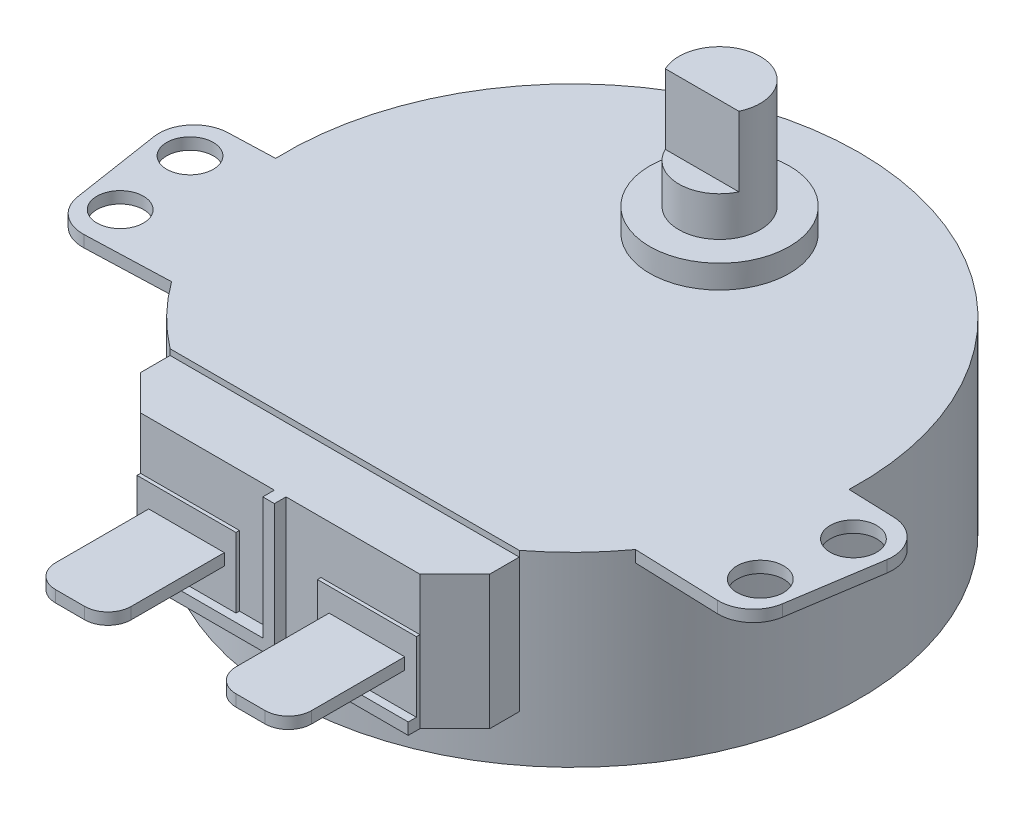
from build123d import *

# Parameters (mm, degrees)
ESBO_O1_W       = 24.65
ESBO_O1_H       = 16
ESBO_O2_W       = 30
ESBO_O2_H       = 12
EXTRUS_O1_DEPTH = 25.1
CHANFRO1_SIZE   = 3
EXTRUS_O2_DEPTH = 1
ESBO_O5_W       = 8.5
ESBO_O5_H       = 6
EXTRUS_O3_DEPTH = 0.3
ESBO_O6_W       = 6.5
ESBO_O6_H       = 1
EXTRUS_O4_DEPTH = 10
ESBO_O7_R       = 2
EXTRUS_O5_DEPTH = 1
FILETE1_R       = 3
ESBO_O8_R       = 6
EXTRUS_O6_DEPTH = 2
ESBO_O9_R       = 3.5
EXTRUS_O7_DEPTH = 9.4
ESBO_O10_W      = 6.32455532
ESBO_O10_H      = 3.599019514
EXTRUS_O8_DEPTH = 6
ESBO_O11_W      = 30
ESBO_O11_H      = 9.10840564
EXTRUS_O9_DEPTH = 0.5
FILETE2_R       = 2


with BuildPart() as part:
    # Esboço1 → Revolução1 (revolve)
    with BuildSketch(Plane.XY, mode=Mode.PRIVATE) as revolu_o1_sk:
        with Locations((-12.325, 8)):
            Rectangle(ESBO_O1_W, ESBO_O1_H)
    revolve(revolu_o1_sk.sketch.rotate(Axis((0, 0, 0), (0, 1, 0)), 270), axis=Axis((0, 0, 0), (0, 1, 0)))

    # Esboço2 → Extrusão1 (add)
    with BuildSketch(Plane.XY):
        with Locations((0, 10)):
            Rectangle(ESBO_O2_W, ESBO_O2_H)
    extrude(amount=EXTRUS_O1_DEPTH)

    # Chanfro1
    chanfro1_edges = [part.edges().sort_by_distance(p)[0] for p in [
        (-15, 10, 25.1),
        (15, 10, 25.1),
    ]]
    chamfer(chanfro1_edges, length=CHANFRO1_SIZE)

    # Esboço4 → Extrusão2 (add)
    with BuildSketch(Plane.XY.offset(25.1)):
        Polygon((-12, 5), (-0.5, 5), (-0.5, 16), (0.5, 16), (0.5, 5), (12, 5), (12, 4), (-12, 4), align=None)
    extrude(amount=EXTRUS_O2_DEPTH)

    # Esboço5 → Extrusão3 (add)
    with BuildSketch(Plane.XY.offset(25.1)):
        with Locations((-7.75, 8)):
            Rectangle(ESBO_O5_W, ESBO_O5_H)
        with Locations((7.75, 8)):
            Rectangle(ESBO_O5_W, ESBO_O5_H)
    extrude(amount=EXTRUS_O3_DEPTH)

    # Esboço6 → Extrusão4 (add)
    with BuildSketch(Plane.XY.offset(25.4)):
        with Locations((-7.75, 8.5)):
            Rectangle(ESBO_O6_W, ESBO_O6_H)
        with Locations((7.75, 8.5)):
            Rectangle(ESBO_O6_W, ESBO_O6_H)
    extrude(amount=EXTRUS_O4_DEPTH)

    # Esboço7 → Extrusão5 (add)
    # profile 1 of 2: a face of its own
    with BuildSketch(Plane(origin=(0, 16, 0), x_dir=(1, 0, 0), z_dir=(0, 1, 0))):
        with BuildLine():
            ThreePointArc((-19.930990459, -14.504417235), (-23.303909287, -8.034320875), (-24.634983886, -0.860272594))
            Line((-24.634983886, -0.860272594), (-32, -1.117464624))
            Line((-32, -1.117464624), (-29.875626197, -14.851691567))
            Line((-29.875626197, -14.851691567), (-19.930990459, -14.504417235))
        make_face()
        with Locations(Location((-27.5, -11.35, 0), (0, 0, 270))):
            Circle(ESBO_O7_R, mode=Mode.SUBTRACT)
        with Locations(Location((-28.5, -4.35, 0), (0, 0, 270))):
            Circle(ESBO_O7_R, mode=Mode.SUBTRACT)
    # profile 2 of 2: a face of its own
    with BuildSketch(Plane(origin=(0, 16, 0), x_dir=(1, 0, 0), z_dir=(0, 1, 0))):
        with BuildLine():
            Line((32, -1.117464624), (24.634983886, -0.860272594))
            ThreePointArc((24.634983886, -0.860272594), (23.303909287, -8.034320875), (19.930990459, -14.504417235))
            Line((19.930990459, -14.504417235), (29.875626197, -14.851691567))
            Line((29.875626197, -14.851691567), (32, -1.117464624))
        make_face()
        with Locations(Location((27.5, -11.35, 0), (0, 0, 270))):
            Circle(ESBO_O7_R, mode=Mode.SUBTRACT)
        with Locations(Location((28.5, -4.35, 0), (0, 0, 270))):
            Circle(ESBO_O7_R, mode=Mode.SUBTRACT)
    extrude(amount=-EXTRUS_O5_DEPTH)

    # Filete1
    filete1_edges = [part.edges().sort_by_distance(p)[0] for p in [
        (-32, 15.5, 1.117464624),
        (-29.875626197, 15.5, 14.851691567),
        (32, 15.5, 1.117464624),
        (29.875626197, 15.5, 14.851691567),
    ]]
    fillet(filete1_edges, radius=FILETE1_R)

    # Esboço8 → Extrusão6 (add)
    with BuildSketch(Plane(origin=(0, 16, 0), x_dir=(1, 0, 0), z_dir=(0, 1, 0))):
        with Locations(Location((0, 12.65, 0), (0, 0, 90))):
            Circle(ESBO_O8_R)
    extrude(amount=EXTRUS_O6_DEPTH)

    # Esboço9 → Extrusão7 (add)
    with BuildSketch(Plane(origin=(0, 18, 0), x_dir=(1, 0, 0), z_dir=(0, 1, 0))):
        with Locations(Location((0, 12.65, 0), (0, 0, 270))):
            Circle(ESBO_O9_R)
    extrude(amount=EXTRUS_O7_DEPTH)

    # Esboço10 → Extrusão8 (cut)
    with BuildSketch(Plane(origin=(0, 27.4, 0), x_dir=(1, 0, 0), z_dir=(0, 1, 0))):
        with Locations((0, 9.350490243)):
            Rectangle(ESBO_O10_W, ESBO_O10_H)
    extrude(amount=-EXTRUS_O8_DEPTH, mode=Mode.SUBTRACT)

    # Esboço11 → Extrusão9 (cut)
    with BuildSketch(Plane(origin=(0, 16, 0), x_dir=(1, 0, 0), z_dir=(0, 1, 0))):
        with Locations((0, -24.114941559)):
            Rectangle(ESBO_O11_W, ESBO_O11_H)
    extrude(amount=-EXTRUS_O9_DEPTH, mode=Mode.SUBTRACT)

    # Filete2
    filete2_edges = [part.edges().sort_by_distance(p)[0] for p in [
        (4.5, 8.5, 35.4),
        (11, 8.5, 35.4),
        (-11, 8.5, 35.4),
        (-4.5, 8.5, 35.4),
    ]]
    fillet(filete2_edges, radius=FILETE2_R)


solid = part.part
